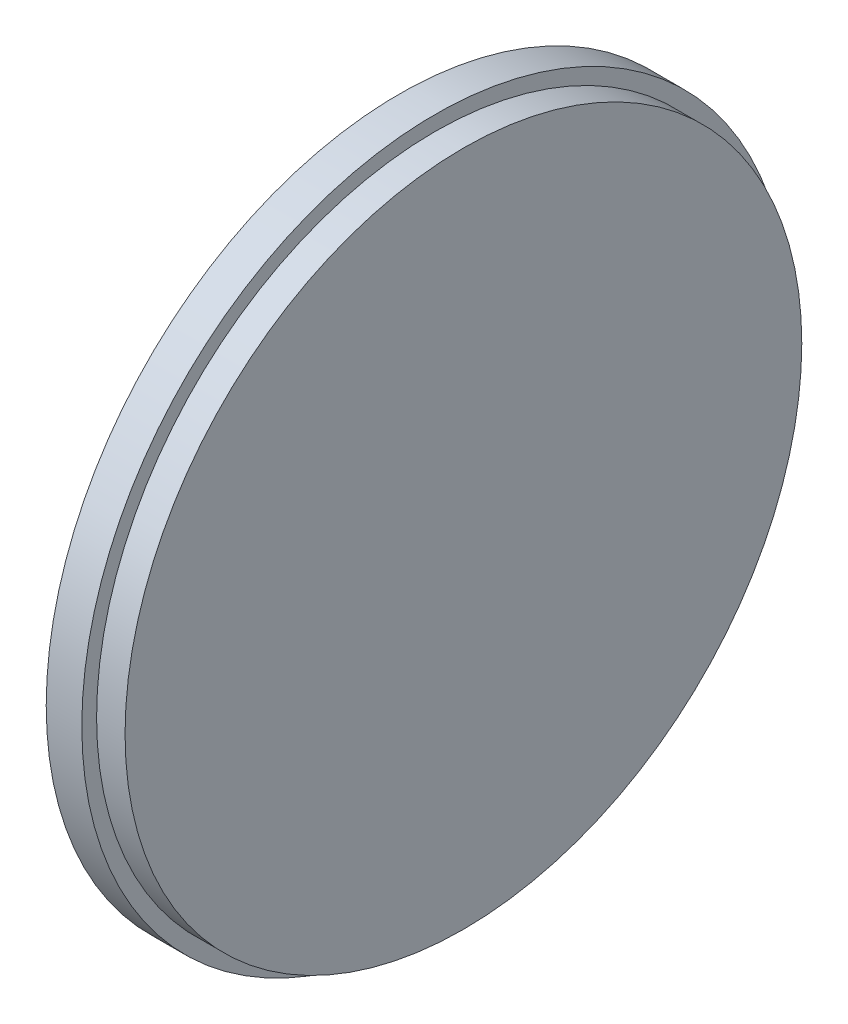
from build123d import *

# Parameters (mm, degrees)
SKETCH1_R           = 32.25
BOSS_EXTRUDE1_DEPTH = 3.25
SKETCH2_R           = 30.9
BOSS_EXTRUDE2_DEPTH = 2.6


with BuildPart() as part:
    # Sketch1 → Boss-Extrude1 (new body)
    with BuildSketch(Plane(origin=(0, 0, 0), x_dir=(0, 0, -1), z_dir=(1, 0, 0))):
        with Locations(Location((0, 0, 0), (0, 0, 180))):
            Circle(SKETCH1_R)
    extrude(amount=BOSS_EXTRUDE1_DEPTH)

    # Sketch2 → Boss-Extrude2 (add)
    with BuildSketch(Plane(origin=(3.25, 0, 0), x_dir=(0, 0, -1), z_dir=(1, 0, 0))):
        Circle(SKETCH2_R)
    extrude(amount=BOSS_EXTRUDE2_DEPTH)


solid = part.part
